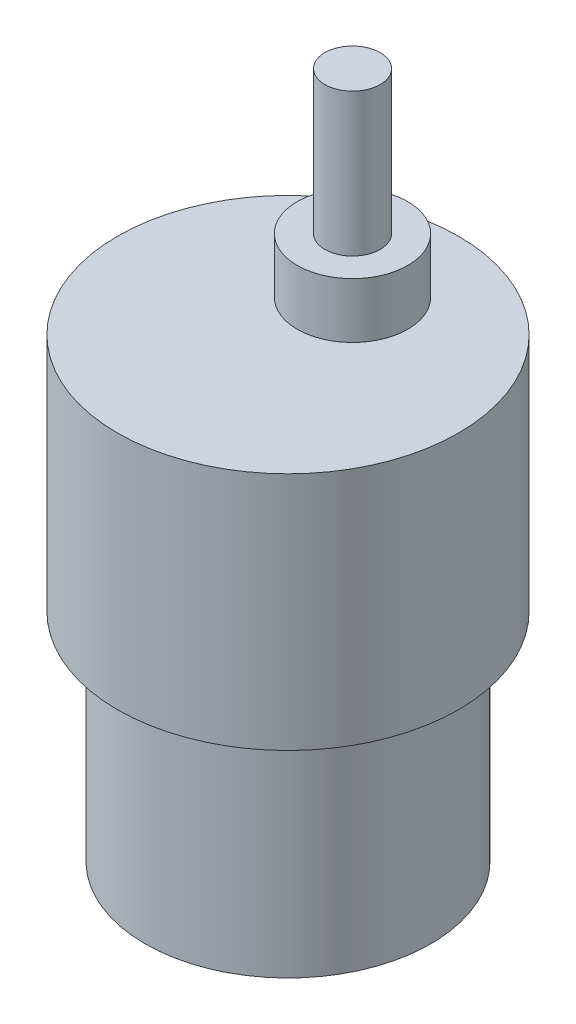
from build123d import *

# Parameters (mm, degrees)
SKETCH1_R           = 15.5
BOSS_EXTRUDE1_DEPTH = 23.5
SKETCH2_R           = 18.5
BOSS_EXTRUDE2_DEPTH = 26
SKETCH3_R           = 6
BOSS_EXTRUDE3_DEPTH = 6
SKETCH4_R           = 3
BOSS_EXTRUDE4_DEPTH = 15.5


with BuildPart() as part:
    # Sketch1 → Boss-Extrude1 (new body)
    with BuildSketch(Plane(origin=(0, 0, 0), x_dir=(1, 0, 0), z_dir=(0, 1, 0))):
        with Locations(Location((0, 0, 0), (0, 0, 270))):
            Circle(SKETCH1_R)
    extrude(amount=BOSS_EXTRUDE1_DEPTH)

    # Sketch2 → Boss-Extrude2 (add)
    with BuildSketch(Plane(origin=(0, 23.5, 0), x_dir=(1, 0, 0), z_dir=(0, 1, 0))):
        with Locations(Location((0, 0, 0), (0, 0, 90))):
            Circle(SKETCH2_R)
    extrude(amount=BOSS_EXTRUDE2_DEPTH)

    # Sketch3 → Boss-Extrude3 (add)
    with BuildSketch(Plane(origin=(0, 49.5, 0), x_dir=(1, 0, 0), z_dir=(0, 1, 0))):
        with Locations(Location((0, 7, 0), (0, 0, 270))):
            Circle(SKETCH3_R)
    extrude(amount=BOSS_EXTRUDE3_DEPTH)

    # Sketch4 → Boss-Extrude4 (add)
    with BuildSketch(Plane(origin=(0, 55.5, 0), x_dir=(1, 0, 0), z_dir=(0, 1, 0))):
        with Locations(Location((0, 7, 0), (0, 0, 270))):
            Circle(SKETCH4_R)
    extrude(amount=BOSS_EXTRUDE4_DEPTH)


solid = part.part
